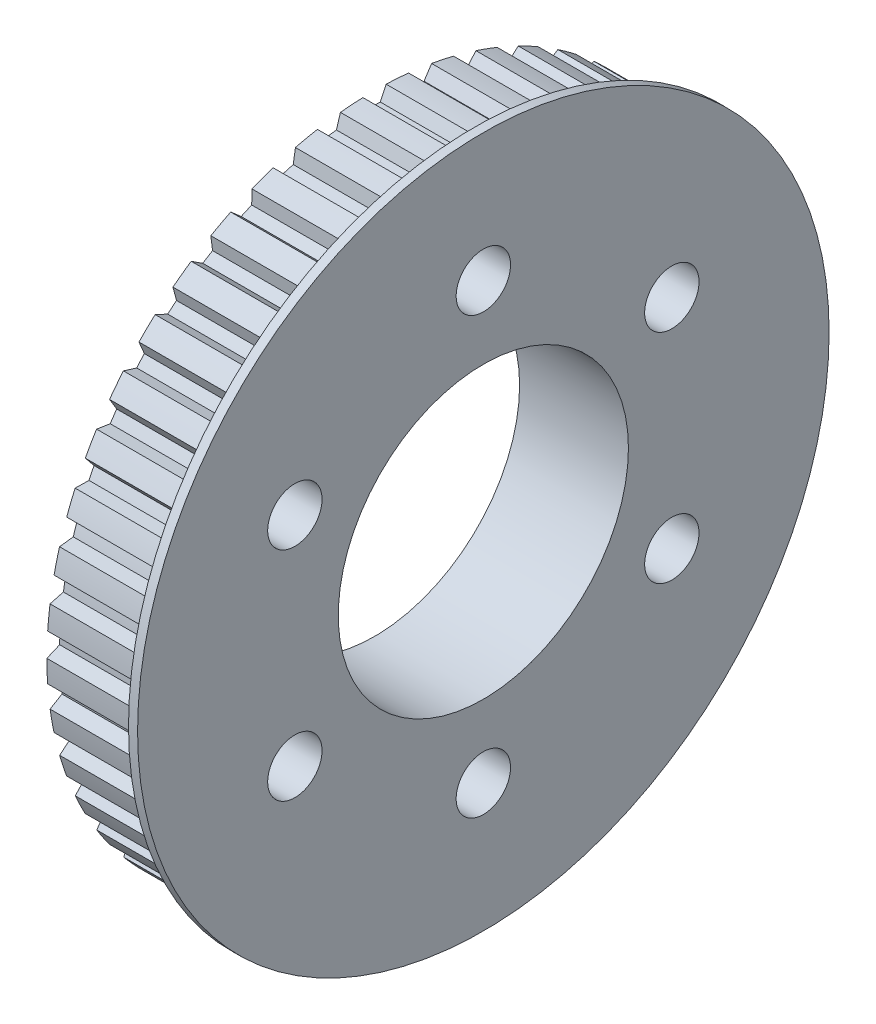
from build123d import *

# Parameters (mm, degrees)
SKETCH1_R           = 36.13
SKETCH1_R_2         = 16
BOSS_EXTRUDE1_DEPTH = 11
CUT_EXTRUDE1_DEPTH  = 53.266182183
SKETCH4_R           = 38.13
SKETCH4_R_2         = 16
BOSS_EXTRUDE2_DEPTH = 1
SKETCH5_R           = 3
CUT_EXTRUDE2_DEPTH  = 56.243043001


with BuildPart() as part:
    # Sketch1 → Boss-Extrude1 (new body)
    with BuildSketch(Plane(origin=(0, 0, 0), x_dir=(0, 0, -1), z_dir=(1, 0, 0))):
        Circle(SKETCH1_R)
        Circle(SKETCH1_R_2, mode=Mode.SUBTRACT)
    extrude(amount=BOSS_EXTRUDE1_DEPTH)

    # Sketch2 → Cut-Extrude1 (cut, through all)
    with BuildSketch(Plane.ZY):
        with BuildLine():
            Line((1.279927221, 36.107321783), (0.63496462, 34.724195022))
            ThreePointArc((0.63496462, 34.724195022), (0, 34.73), (-0.63496462, 34.724195022))
            Line((-0.63496462, 34.724195022), (-1.279927221, 36.107321783))
            ThreePointArc((-1.279927221, 36.107321783), (0, 36.13), (1.279927221, 36.107321783))
        make_face()
        with BuildLine():
            Line((6.292638997, 35.577796369), (5.461459088, 34.297891548))
            ThreePointArc((5.461459088, 34.297891548), (4.833481796, 34.392010027), (4.203888711, 34.474631538))
            Line((4.203888711, 34.474631538), (3.757696883, 35.934059249))
            ThreePointArc((3.757696883, 35.934059249), (5.028324138, 35.778385324), (6.292638997, 35.577796369))
        make_face()
        with BuildLine():
            Line((11.182871713, 34.355789618), (10.181652467, 33.204018628))
            ThreePointArc((10.181652467, 33.204018628), (9.572885368, 33.3846187), (8.960918131, 33.554058566))
            Line((8.960918131, 33.554058566), (8.722181691, 35.061381127))
            ThreePointArc((8.722181691, 35.061381127), (9.958777666, 34.730385074), (11.182871713, 34.355789618))
        make_face()
        with BuildLine():
            Line((15.855442551, 32.465086501), (14.703671562, 31.463867255))
            ThreePointArc((14.703671562, 31.463867255), (14.125963614, 31.727433744), (13.543533472, 31.980394011))
            Line((13.543533472, 31.980394011), (13.516899153, 33.506273103))
            ThreePointArc((13.516899153, 33.506273103), (14.695394914, 33.006397385), (15.855442551, 32.465086501))
        make_face()
        with BuildLine():
            Line((20.219405235, 29.942487404), (18.939500415, 29.111307495))
            ThreePointArc((18.939500415, 29.111307495), (18.404096047, 29.45271038), (17.86253934, 29.784267463))
            Line((17.86253934, 29.784267463), (18.048525549, 31.299003586))
            ThreePointArc((18.048525549, 31.299003586), (19.145983017, 30.639977714), (20.219405235, 29.942487404))
        make_face()
        with BuildLine():
            Line((24.189820196, 26.837091848), (22.806693436, 26.192129248))
            ThreePointArc((22.806693436, 26.192129248), (22.324013684, 26.60472351), (21.833871198, 27.008424029))
            Line((21.833871198, 27.008424029), (22.228857926, 28.482534566))
            ThreePointArc((22.228857926, 28.482534566), (23.223916338, 27.67718573), (24.189820196, 26.837091848))
        make_face()
        with BuildLine():
            Line((27.689407822, 23.209342827), (26.229980111, 22.763150998))
            ThreePointArc((26.229980111, 22.763150998), (25.809419789, 23.238905959), (25.380231588, 23.706892342))
            Line((25.380231588, 23.706892342), (25.976530867, 25.11168541))
            ThreePointArc((25.976530867, 25.11168541), (26.849822544, 24.175688808), (27.689407822, 23.209342827))
        make_face()
        with BuildLine():
            Line((30.650052621, 19.129850348), (29.14273006, 18.891113908))
            ThreePointArc((29.14273006, 18.891113908), (28.792474895, 19.420769538), (28.43259464, 19.943932963))
            Line((28.43259464, 19.943932963), (29.218600183, 21.25206586))
            ThreePointArc((29.218600183, 21.25206586), (29.953127496, 20.203639602), (30.650052621, 19.129850348))
        make_face()
        with BuildLine():
            Line((33.01412901, 14.678017091), (31.488249917, 14.651382773))
            ThreePointArc((31.488249917, 14.651382773), (31.215117228, 15.224629928), (30.93154958, 15.792787614))
            Line((30.93154958, 15.792787614), (31.891962682, 16.978799023))
            ThreePointArc((31.891962682, 16.978799023), (32.473428893, 15.838349533), (33.01412901, 14.678017091))
        make_face()
        with BuildLine():
            Line((34.73562293, 9.940492928), (33.220886807, 10.126479138))
            ThreePointArc((33.220886807, 10.126479138), (33.030192811, 10.732160215), (32.82845709, 11.334253618))
            Line((32.82845709, 11.334253618), (33.944584404, 12.375059176))
            ThreePointArc((33.944584404, 12.375059176), (34.361671934, 11.164784007), (34.73562293, 9.940492928))
        make_face()
        with BuildLine():
            Line((35.781027461, 5.009488377), (34.306916924, 5.404475105))
            ThreePointArc((34.306916924, 5.404475105), (34.202373262, 6.03080121), (34.086396026, 6.655111268))
            Line((34.086396026, 6.655111268), (35.336513402, 7.530452879))
            ThreePointArc((35.336513402, 7.530452879), (35.581104116, 6.273908659), (35.781027461, 5.009488377))
        make_face()
        with BuildLine():
            Line((36.129994994, -0.019020166), (34.725201926, 0.577279113))
            ThreePointArc((34.725201926, 0.577279113), (34.708843422, 1.21205952), (34.680882035, 1.846434747))
            Line((34.680882035, 1.846434747), (36.040657362, 2.539274881))
            ThreePointArc((36.040657362, 2.539274881), (36.10799058, 1.260918816), (36.129994994, -0.019020166))
        make_face()
        with BuildLine():
            Line((35.77573327, -5.047158504), (34.467600372, -4.261152962))
            ThreePointArc((34.467600372, -4.261152962), (34.539745426, -3.630273529), (34.600344124, -2.998180526))
            Line((34.600344124, -2.998180526), (36.043310921, -2.501327213))
            ThreePointArc((36.043310921, -2.501327213), (35.93207608, -3.776613378), (35.77573327, -5.047158504))
        make_face()
        with BuildLine():
            Line((34.725137593, -9.977059643), (33.539126184, -9.01664654))
            ThreePointArc((33.539126184, -9.01664654), (33.698370574, -8.401947434), (33.846349873, -7.784439625))
            Line((33.846349873, -7.784439625), (35.344422432, -7.493243818))
            ThreePointArc((35.344422432, -7.493243818), (35.05678459, -8.740638088), (34.725137593, -9.977059643))
        make_face()
        with BuildLine():
            Line((32.998656612, -14.712768665), (31.957851054, -13.596641351))
            ThreePointArc((31.957851054, -13.596641351), (32.201095269, -13.010086989), (32.433574921, -12.419183462))
            Line((32.433574921, -12.419183462), (33.957594965, -12.339312956))
            ThreePointArc((33.957594965, -12.339312956), (33.499152665, -13.53453622), (32.998656612, -14.712768665))
        make_face()
        with BuildLine():
            Line((30.629894316, -19.16211038), (29.754552705, -17.911993003))
            ThreePointArc((29.754552705, -17.911993003), (30.077062273, -17.365), (30.389517325, -16.812202019))
            Line((30.389517325, -16.812202019), (31.909821537, -16.945211403))
            ThreePointArc((31.909821537, -16.945211403), (31.289497839, -18.065), (30.629894316, -19.16211038))
        make_face()
        with BuildLine():
            Line((27.664955967, -23.238483413), (26.972115833, -21.878708086))
            ThreePointArc((26.972115833, -21.878708086), (27.367613473, -21.381923038), (27.753962343, -20.877990188))
            Line((27.753962343, -20.877990188), (29.24095973, -21.221290585))
            ThreePointArc((29.24095973, -21.221290585), (28.470828528, -22.243849104), (27.664955967, -23.238483413))
        make_face()
        with BuildLine():
            Line((24.16155072, -26.862545799), (23.664697406, -25.419579003))
            ThreePointArc((23.664697406, -25.419579003), (24.125485206, -24.982671266), (24.578208053, -24.537412026))
            Line((24.578208053, -24.537412026), (26.002955903, -25.084321484))
            ThreePointArc((26.002955903, -25.084321484), (25.098006925, -25.989746986), (24.16155072, -26.862545799))
        make_face()
        with BuildLine():
            Line((20.18786837, -29.963759288), (19.896672563, -28.465686728))
            ThreePointArc((19.896672563, -28.465686728), (20.413781812, -28.097160215), (20.9240669, -27.719241049))
            Line((20.9240669, -27.719241049), (22.258834117, -28.459114599))
            ThreePointArc((22.258834117, -28.459114599), (21.236681165, -29.229784007), (20.18786837, -29.963759288))
        make_face()
        with BuildLine():
            Line((15.821252126, -32.481762285), (15.74138162, -30.957742241))
            ThreePointArc((15.74138162, -30.957742241), (16.304747376, -30.6647699), (16.862662587, -30.361546576))
            Line((16.862662587, -30.361546576), (18.081469444, -31.27998342))
            ThreePointArc((18.081469444, -31.27998342), (16.962007563, -31.90089653), (15.821252126, -32.481762285))
        make_face()
        with BuildLine():
            Line((11.146693206, -34.367544727), (11.27970259, -32.847240515))
            ThreePointArc((11.27970259, -32.847240515), (11.878359578, -32.63552472), (12.473045727, -32.412899135))
            Line((12.473045727, -32.412899135), (13.552169536, -33.492022944))
            ThreePointArc((13.552169536, -33.492022944), (12.357187778, -33.951094389), (11.146693206, -34.367544727))
        make_face()
        with BuildLine():
            Line((6.255176582, -35.584402003), (6.598476979, -34.097404616))
            ThreePointArc((6.598476979, -34.097404616), (7.220773022, -33.971066173), (7.840655219, -33.83337148))
            Line((7.840655219, -33.83337148), (8.759092063, -35.052178338))
            ThreePointArc((8.759092063, -35.052178338), (7.511849389, -35.340472815), (6.255176582, -35.584402003))
        make_face()
        with BuildLine():
            Line((1.241910061, -36.108649371), (1.78881952, -34.683901521))
            ThreePointArc((1.78881952, -34.683901521), (2.422642333, -34.645399466), (3.055655277, -34.595315735))
            Line((3.055655277, -34.595315735), (3.795528827, -35.930082952))
            ThreePointArc((3.795528827, -35.930082952), (2.520301396, -36.041989136), (1.241910061, -36.108649371))
        make_face()
        with BuildLine():
            Line((-3.795528827, -35.930082952), (-3.055655277, -34.595315735))
            ThreePointArc((-3.055655277, -34.595315735), (-2.422642333, -34.645399466), (-1.78881952, -34.683901521))
            Line((-1.78881952, -34.683901521), (-1.241910061, -36.108649371))
            ThreePointArc((-1.241910061, -36.108649371), (-2.520301396, -36.041989136), (-3.795528827, -35.930082952))
        make_face()
        with BuildLine():
            Line((-8.759092063, -35.052178338), (-7.840655219, -33.83337148))
            ThreePointArc((-7.840655219, -33.83337148), (-7.220773022, -33.971066173), (-6.598476979, -34.097404616))
            Line((-6.598476979, -34.097404616), (-6.255176582, -35.584402003))
            ThreePointArc((-6.255176582, -35.584402003), (-7.511849389, -35.340472815), (-8.759092063, -35.052178338))
        make_face()
        with BuildLine():
            Line((-13.552169536, -33.492022944), (-12.473045727, -32.412899135))
            ThreePointArc((-12.473045727, -32.412899135), (-11.878359578, -32.63552472), (-11.27970259, -32.847240515))
            Line((-11.27970259, -32.847240515), (-11.146693206, -34.367544727))
            ThreePointArc((-11.146693206, -34.367544727), (-12.357187778, -33.951094389), (-13.552169536, -33.492022944))
        make_face()
        with BuildLine():
            Line((-18.081469444, -31.27998342), (-16.862662587, -30.361546576))
            ThreePointArc((-16.862662587, -30.361546576), (-16.304747376, -30.6647699), (-15.74138162, -30.957742241))
            Line((-15.74138162, -30.957742241), (-15.821252126, -32.481762285))
            ThreePointArc((-15.821252126, -32.481762285), (-16.962007563, -31.90089653), (-18.081469444, -31.27998342))
        make_face()
        with BuildLine():
            Line((-22.258834117, -28.459114599), (-20.9240669, -27.719241049))
            ThreePointArc((-20.9240669, -27.719241049), (-20.413781812, -28.097160215), (-19.896672563, -28.465686728))
            Line((-19.896672563, -28.465686728), (-20.18786837, -29.963759288))
            ThreePointArc((-20.18786837, -29.963759288), (-21.236681165, -29.229784007), (-22.258834117, -28.459114599))
        make_face()
        with BuildLine():
            Line((-26.002955903, -25.084321484), (-24.578208053, -24.537412026))
            ThreePointArc((-24.578208053, -24.537412026), (-24.125485206, -24.982671266), (-23.664697406, -25.419579003))
            Line((-23.664697406, -25.419579003), (-24.16155072, -26.862545799))
            ThreePointArc((-24.16155072, -26.862545799), (-25.098006925, -25.989746986), (-26.002955903, -25.084321484))
        make_face()
        with BuildLine():
            Line((-29.24095973, -21.221290585), (-27.753962343, -20.877990188))
            ThreePointArc((-27.753962343, -20.877990188), (-27.367613473, -21.381923038), (-26.972115833, -21.878708086))
            Line((-26.972115833, -21.878708086), (-27.664955967, -23.238483413))
            ThreePointArc((-27.664955967, -23.238483413), (-28.470828528, -22.243849104), (-29.24095973, -21.221290585))
        make_face()
        with BuildLine():
            Line((-31.909821537, -16.945211403), (-30.389517325, -16.812202019))
            ThreePointArc((-30.389517325, -16.812202019), (-30.077062273, -17.365), (-29.754552705, -17.911993003))
            Line((-29.754552705, -17.911993003), (-30.629894316, -19.16211038))
            ThreePointArc((-30.629894316, -19.16211038), (-31.289497839, -18.065), (-31.909821537, -16.945211403))
        make_face()
        with BuildLine():
            Line((-33.957594965, -12.339312956), (-32.433574921, -12.419183462))
            ThreePointArc((-32.433574921, -12.419183462), (-32.201095269, -13.010086989), (-31.957851054, -13.596641351))
            Line((-31.957851054, -13.596641351), (-32.998656612, -14.712768665))
            ThreePointArc((-32.998656612, -14.712768665), (-33.499152665, -13.53453622), (-33.957594965, -12.339312956))
        make_face()
        with BuildLine():
            Line((-35.344422432, -7.493243818), (-33.846349873, -7.784439625))
            ThreePointArc((-33.846349873, -7.784439625), (-33.698370574, -8.401947434), (-33.539126184, -9.01664654))
            Line((-33.539126184, -9.01664654), (-34.725137593, -9.977059643))
            ThreePointArc((-34.725137593, -9.977059643), (-35.05678459, -8.740638088), (-35.344422432, -7.493243818))
        make_face()
        with BuildLine():
            Line((-36.043310921, -2.501327213), (-34.600344124, -2.998180526))
            ThreePointArc((-34.600344124, -2.998180526), (-34.539745426, -3.630273529), (-34.467600372, -4.261152962))
            Line((-34.467600372, -4.261152962), (-35.77573327, -5.047158504))
            ThreePointArc((-35.77573327, -5.047158504), (-35.93207608, -3.776613378), (-36.043310921, -2.501327213))
        make_face()
        with BuildLine():
            Line((-36.040657362, 2.539274881), (-34.680882035, 1.846434747))
            ThreePointArc((-34.680882035, 1.846434747), (-34.708843422, 1.21205952), (-34.725201926, 0.577279113))
            Line((-34.725201926, 0.577279113), (-36.129994994, -0.019020166))
            ThreePointArc((-36.129994994, -0.019020166), (-36.10799058, 1.260918816), (-36.040657362, 2.539274881))
        make_face()
        with BuildLine():
            Line((-35.336513402, 7.530452879), (-34.086396026, 6.655111268))
            ThreePointArc((-34.086396026, 6.655111268), (-34.202373262, 6.03080121), (-34.306916924, 5.404475105))
            Line((-34.306916924, 5.404475105), (-35.781027461, 5.009488377))
            ThreePointArc((-35.781027461, 5.009488377), (-35.581104116, 6.273908659), (-35.336513402, 7.530452879))
        make_face()
        with BuildLine():
            Line((-33.944584404, 12.375059176), (-32.82845709, 11.334253618))
            ThreePointArc((-32.82845709, 11.334253618), (-33.030192811, 10.732160215), (-33.220886807, 10.126479138))
            Line((-33.220886807, 10.126479138), (-34.73562293, 9.940492928))
            ThreePointArc((-34.73562293, 9.940492928), (-34.361671934, 11.164784007), (-33.944584404, 12.375059176))
        make_face()
        with BuildLine():
            Line((-31.891962682, 16.978799023), (-30.93154958, 15.792787614))
            ThreePointArc((-30.93154958, 15.792787614), (-31.215117228, 15.224629928), (-31.488249917, 14.651382773))
            Line((-31.488249917, 14.651382773), (-33.01412901, 14.678017091))
            ThreePointArc((-33.01412901, 14.678017091), (-32.473428893, 15.838349533), (-31.891962682, 16.978799023))
        make_face()
        with BuildLine():
            Line((-29.218600183, 21.25206586), (-28.43259464, 19.943932963))
            ThreePointArc((-28.43259464, 19.943932963), (-28.792474895, 19.420769538), (-29.14273006, 18.891113908))
            Line((-29.14273006, 18.891113908), (-30.650052621, 19.129850348))
            ThreePointArc((-30.650052621, 19.129850348), (-29.953127496, 20.203639602), (-29.218600183, 21.25206586))
        make_face()
        with BuildLine():
            Line((-25.976530867, 25.11168541), (-25.380231588, 23.706892342))
            ThreePointArc((-25.380231588, 23.706892342), (-25.809419789, 23.238905959), (-26.229980111, 22.763150998))
            Line((-26.229980111, 22.763150998), (-27.689407822, 23.209342827))
            ThreePointArc((-27.689407822, 23.209342827), (-26.849822544, 24.175688808), (-25.976530867, 25.11168541))
        make_face()
        with BuildLine():
            Line((-22.228857926, 28.482534566), (-21.833871198, 27.008424029))
            ThreePointArc((-21.833871198, 27.008424029), (-22.324013684, 26.60472351), (-22.806693436, 26.192129248))
            Line((-22.806693436, 26.192129248), (-24.189820196, 26.837091848))
            ThreePointArc((-24.189820196, 26.837091848), (-23.223916338, 27.67718573), (-22.228857926, 28.482534566))
        make_face()
        with BuildLine():
            Line((-18.048525549, 31.299003586), (-17.86253934, 29.784267463))
            ThreePointArc((-17.86253934, 29.784267463), (-18.404096047, 29.45271038), (-18.939500415, 29.111307495))
            Line((-18.939500415, 29.111307495), (-20.219405235, 29.942487404))
            ThreePointArc((-20.219405235, 29.942487404), (-19.145983017, 30.639977714), (-18.048525549, 31.299003586))
        make_face()
        with BuildLine():
            Line((-13.516899153, 33.506273103), (-13.543533472, 31.980394011))
            ThreePointArc((-13.543533472, 31.980394011), (-14.125963614, 31.727433744), (-14.703671562, 31.463867255))
            Line((-14.703671562, 31.463867255), (-15.855442551, 32.465086501))
            ThreePointArc((-15.855442551, 32.465086501), (-14.695394914, 33.006397385), (-13.516899153, 33.506273103))
        make_face()
        with BuildLine():
            Line((-8.722181691, 35.061381127), (-8.960918131, 33.554058566))
            ThreePointArc((-8.960918131, 33.554058566), (-9.572885368, 33.3846187), (-10.181652467, 33.204018628))
            Line((-10.181652467, 33.204018628), (-11.182871713, 34.355789618))
            ThreePointArc((-11.182871713, 34.355789618), (-9.958777666, 34.730385074), (-8.722181691, 35.061381127))
        make_face()
        with BuildLine():
            Line((-3.757696883, 35.934059249), (-4.203888711, 34.474631538))
            ThreePointArc((-4.203888711, 34.474631538), (-4.833481796, 34.392010027), (-5.461459088, 34.297891548))
            Line((-5.461459088, 34.297891548), (-6.292638997, 35.577796369))
            ThreePointArc((-6.292638997, 35.577796369), (-5.028324138, 35.778385324), (-3.757696883, 35.934059249))
        make_face()
    extrude(amount=-CUT_EXTRUDE1_DEPTH, mode=Mode.SUBTRACT)

    # Sketch4 → Boss-Extrude2 (add)
    with BuildSketch(Plane(origin=(11, 0, 0), x_dir=(0, 0, -1), z_dir=(1, 0, 0))):
        Circle(SKETCH4_R)
        Circle(SKETCH4_R_2, mode=Mode.SUBTRACT)
    extrude(amount=BOSS_EXTRUDE2_DEPTH)

    # Sketch5 → Cut-Extrude2 (cut, through all)
    with BuildSketch(Plane.ZY):
        with Locations((0, -24)):
            Circle(SKETCH5_R)
        with Locations((-20.784609691, -12)):
            Circle(SKETCH5_R)
        with Locations((-20.784609691, 12)):
            Circle(SKETCH5_R)
        with Locations((0, 24)):
            Circle(SKETCH5_R)
        with Locations((20.784609691, 12)):
            Circle(SKETCH5_R)
        with Locations((20.784609691, -12)):
            Circle(SKETCH5_R)
    extrude(amount=-CUT_EXTRUDE2_DEPTH, mode=Mode.SUBTRACT)


solid = part.part
